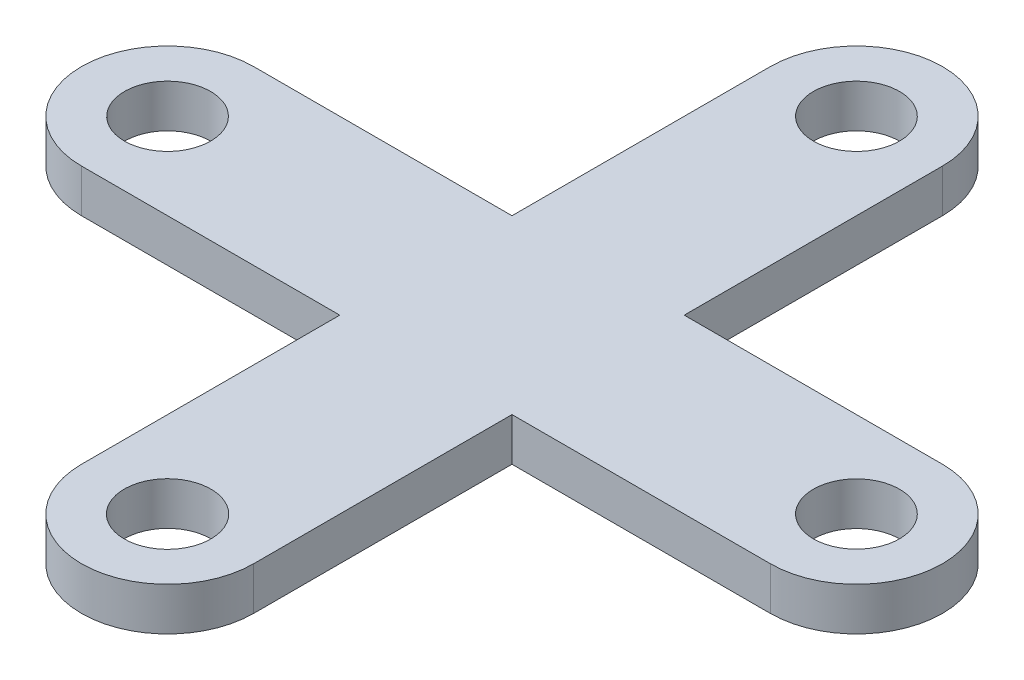
from build123d import *

# Parameters (mm, degrees)
SKETCH1_W           = 25.4
SKETCH1_H           = 25.4
BOSS_EXTRUDE1_DEPTH = 6.35
SKETCH2_R           = 6.35
SKETCH2_R_2         = 6.382099354
CUT_EXTRUDE1_DEPTH  = 108.784518461
SKETCH3_W           = 24.960329338
SKETCH3_H           = 23.230097692
CUT_EXTRUDE2_DEPTH  = 2.54


with BuildPart() as part:
    # Sketch1 → Boss-Extrude1 (new body)
    with BuildSketch(Plane(origin=(0, 0, 0), x_dir=(1, 0, 0), z_dir=(0, 1, 0))):
        with BuildLine():
            Line((12.7, 36.061556053), (12.7, 74.161556053))
            ThreePointArc((12.7, 74.161556053), (0, 86.861556053), (-12.7, 74.161556053))
            Line((-12.7, 74.161556053), (-12.7, 36.061556053))
            Line((-12.7, 36.061556053), (12.7, 36.061556053))
        make_face()
        with BuildLine():
            Line((50.8, 36.061556053), (12.7, 36.061556053))
            Line((12.7, 36.061556053), (12.7, 10.661556053))
            Line((12.7, 10.661556053), (50.8, 10.661556053))
            ThreePointArc((50.8, 10.661556053), (63.5, 23.361556053), (50.8, 36.061556053))
        make_face()
        with BuildLine():
            Line((12.7, -27.438443947), (12.7, 10.661556053))
            Line((12.7, 10.661556053), (-12.7, 10.661556053))
            Line((-12.7, 10.661556053), (-12.7, -27.438443947))
            ThreePointArc((-12.7, -27.438443947), (0, -40.138443947), (12.7, -27.438443947))
        make_face()
        with BuildLine():
            Line((-12.7, 10.661556053), (-12.7, 36.061556053))
            Line((-12.7, 36.061556053), (-50.8, 36.061556053))
            ThreePointArc((-50.8, 36.061556053), (-63.5, 23.361556053), (-50.8, 10.661556053))
            Line((-50.8, 10.661556053), (-12.7, 10.661556053))
        make_face()
        with Locations((0, 23.361556053)):
            Rectangle(SKETCH1_W, SKETCH1_H)
    extrude(amount=BOSS_EXTRUDE1_DEPTH)

    # Sketch2 → Cut-Extrude1 (cut, through all)
    with BuildSketch(Plane(origin=(0, 6.35, 0), x_dir=(1, 0, 0), z_dir=(0, 1, 0))):
        with Locations(Location((0, 74.161556053, 0), (0, 0, 270))):
            Circle(SKETCH2_R)
        with Locations(Location((-50.8, 23.361556053, 0), (0, 0, 270))):
            Circle(SKETCH2_R)
        with Locations(Location((0, -27.438443947, 0), (0, 0, 270))):
            Circle(SKETCH2_R_2)
        with Locations(Location((50.8, 23.361556053, 0), (0, 0, 270))):
            Circle(SKETCH2_R)
    extrude(amount=-CUT_EXTRUDE1_DEPTH, mode=Mode.SUBTRACT)

    # Sketch3 → Cut-Extrude2 (cut)
    with BuildSketch(Plane(origin=(0, 0, 0), x_dir=(1, 0, 0), z_dir=(0, 1, 0))):
        with Locations((-0.219835331, 23.57664955)):
            Rectangle(SKETCH3_W, SKETCH3_H)
    extrude(amount=CUT_EXTRUDE2_DEPTH, mode=Mode.SUBTRACT)


solid = part.part
